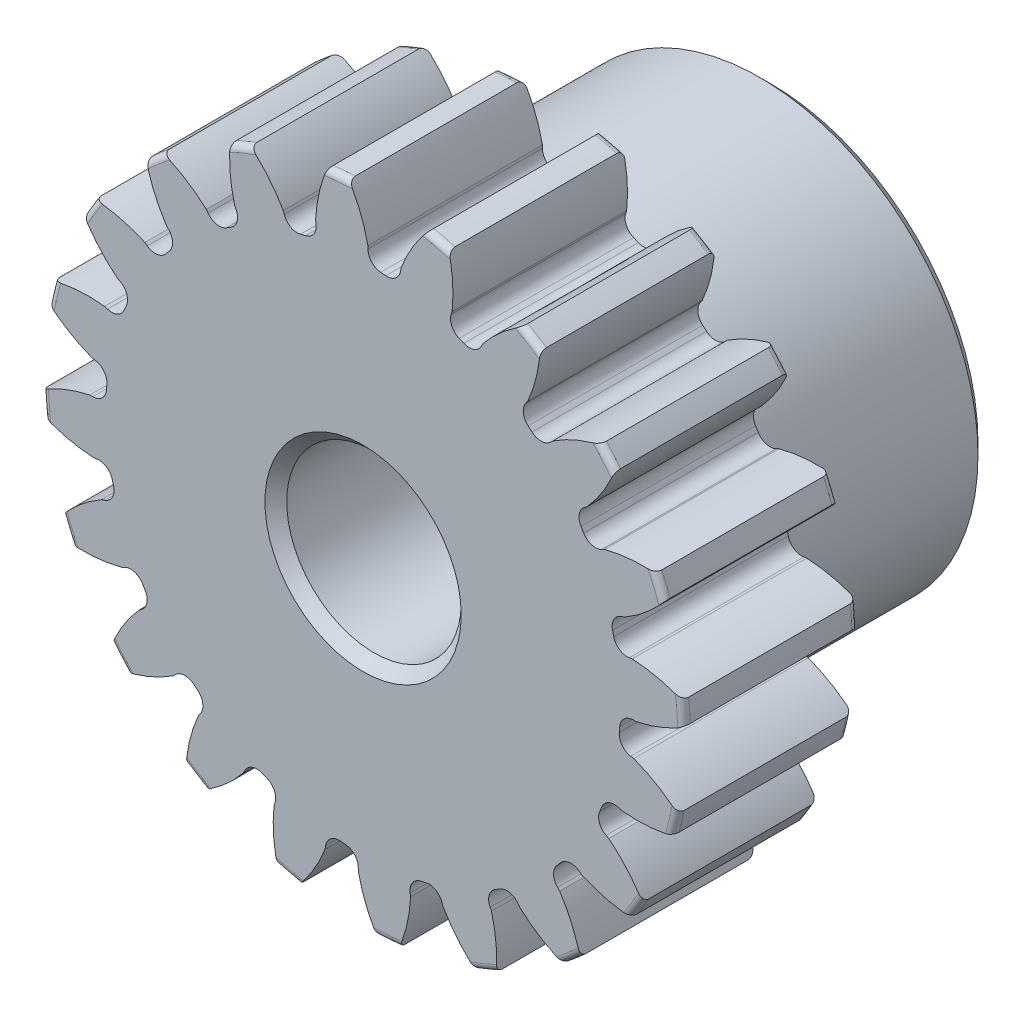
from build123d import *

# Parameters (mm, degrees)
SKETCH1_R                = 8.763
BOSS_EXTRUDE1_DEPTH      = 4.7625
SKETCH2_W                = 6.3627
SKETCH2_H                = 5.953125
FILLET2_R                = 0.17526
CUT_EXTRUDE1_DEPTH       = 17.653840789
FILLET1_R                = 0.37404675
CIRPATTERN1_COUNT        = 20
FILLET1_OF_CIRPATTERN1_R = 0.37404675
SKETCH5_R                = 2.38125
CUT_EXTRUDE2_DEPTH       = 17.644788953
CHAMFER1_SIZE            = 0.29765625


with BuildPart() as part:
    # Sketch1 → Boss-Extrude1 (new body)
    with BuildSketch(Plane.XY):
        Circle(SKETCH1_R)
    extrude(amount=-BOSS_EXTRUDE1_DEPTH)

    # Sketch2 → Revolve1 (revolve)
    with BuildSketch(Plane(origin=(0, 0, 0), x_dir=(0, 0, -1), z_dir=(1, 0, 0)), mode=Mode.PRIVATE) as revolve1_sk:
        with Locations((7.94385, 2.9765625)):
            Rectangle(SKETCH2_W, SKETCH2_H)
    revolve(revolve1_sk.sketch.rotate(Axis((0, 0, -4.7625), (0, 0, -1)), 90), axis=Axis((0, 0, -4.7625), (0, 0, -1)))

    # Fillet2
    fillet2_edges = [part.edges().sort_by_distance(p)[0] for p in [
        (-8.763, 0, 0),
        (-8.763, 0, -4.7625),
        (-5.953125, 0, -4.7625),
    ]]
    fillet(fillet2_edges, radius=FILLET2_R)

    # Sketch4 → Cut-Extrude1 (cut, through all)
    with BuildSketch(Plane.XY):
        with BuildLine():
            Line((0.131764687, 7.457646233), (0.131764687, 7.017894383))
            ThreePointArc((0.131764687, 7.017894383), (0.550715976, 6.99749351), (0.967700662, 6.952104641))
            Line((0.967700662, 6.952104641), (1.036493167, 7.38644239))
            add(Edge.make_bspline(
                [(3.690312257, 9.886935858), (1.697229771, 9.111844986), (1.036493167, 7.38644239)],
                knots=[0, 0, 0, 1, 1, 1], degree=2))
            ThreePointArc((3.690312257, 9.886935858), (0.827995997, 10.520661949), (-2.098217069, 10.342504066))
            add(Edge.make_bspline(
                [(-2.098217069, 10.342504066), (-0.250924056, 9.265168378), (0.131764687, 7.457646233)],
                knots=[0, 0, 0, 1, 1, 1], degree=2))
        make_face()
    cut_extrude1 = extrude(amount=-CUT_EXTRUDE1_DEPTH, mode=Mode.SUBTRACT)

    # Fillet1
    fillet1_edges = [part.edges().sort_by_distance(p)[0] for p in [
        (0.967700662, 6.952104641, -2.38125),
        (0.131764687, 7.017894383, -2.38125),
    ]]
    fillet(fillet1_edges, radius=FILLET1_R)

    # CirPattern1: Cut-Extrude1 ×20 about axis
    cirpattern1_axis = Axis((0, 0, -4.7625), (0, 0, 1))
    for i in range(1, CIRPATTERN1_COUNT):
        add(cut_extrude1.rotate(cirpattern1_axis, i * 360 / CIRPATTERN1_COUNT), mode=Mode.SUBTRACT)

    # Fillet1 of CirPattern1
    fillet1_of_cirpattern1_edges = [part.edges().sort_by_distance(p)[0] for p in [
        (-1.22798046, 6.91088037, -2.38125),
        (-2.043332965, 6.715131711, -2.38125),
        (-3.303458299, 6.193170979, -2.38125),
        (-4.01841495, 5.75504516, -2.38125),
        (-5.055570623, 4.869230861, -2.38125),
        (-5.600146481, 4.231614691, -2.38125),
        (-6.31280847, 3.068656501, -2.38125),
        (-6.633696656, 2.293964293, -2.38125),
        (-6.952104641, 0.967700662, -2.38125),
        (-7.017894383, 0.131764687, -2.38125),
        (-6.91088037, -1.22798046, -2.38125),
        (-6.715131711, -2.043332965, -2.38125),
        (-6.193170979, -3.303458299, -2.38125),
        (-5.75504516, -4.01841495, -2.38125),
        (-4.869230861, -5.055570623, -2.38125),
        (-4.231614691, -5.600146481, -2.38125),
        (-3.068656501, -6.31280847, -2.38125),
        (-2.293964293, -6.633696656, -2.38125),
        (-0.967700662, -6.952104641, -2.38125),
        (-0.131764687, -7.017894383, -2.38125),
        (1.22798046, -6.91088037, -2.38125),
        (2.043332965, -6.715131711, -2.38125),
        (3.303458299, -6.193170979, -2.38125),
        (4.01841495, -5.75504516, -2.38125),
        (5.055570623, -4.869230861, -2.38125),
        (5.600146481, -4.231614691, -2.38125),
        (6.31280847, -3.068656501, -2.38125),
        (6.633696656, -2.293964293, -2.38125),
        (6.952104641, -0.967700662, -2.38125),
        (7.017894383, -0.131764687, -2.38125),
        (6.91088037, 1.22798046, -2.38125),
        (6.715131711, 2.043332965, -2.38125),
        (6.193170979, 3.303458299, -2.38125),
        (5.75504516, 4.01841495, -2.38125),
        (4.869230861, 5.055570623, -2.38125),
        (4.231614691, 5.600146481, -2.38125),
        (3.068656501, 6.31280847, -2.38125),
        (2.293964293, 6.633696656, -2.38125),
    ]]
    fillet(fillet1_of_cirpattern1_edges, radius=FILLET1_OF_CIRPATTERN1_R)

    # Sketch5 → Cut-Extrude2 (cut, through all)
    with BuildSketch(Plane.XY):
        Circle(SKETCH5_R)
    extrude(amount=-CUT_EXTRUDE2_DEPTH, mode=Mode.SUBTRACT)

    # Chamfer1
    chamfer1_edges = [part.edges().sort_by_distance(p)[0] for p in [
        (-5.953125, 0, -11.1252),
        (-2.38125, 0, -11.1252),
        (-2.38125, 0, 0),
    ]]
    chamfer(chamfer1_edges, length=CHAMFER1_SIZE)


solid = part.part
